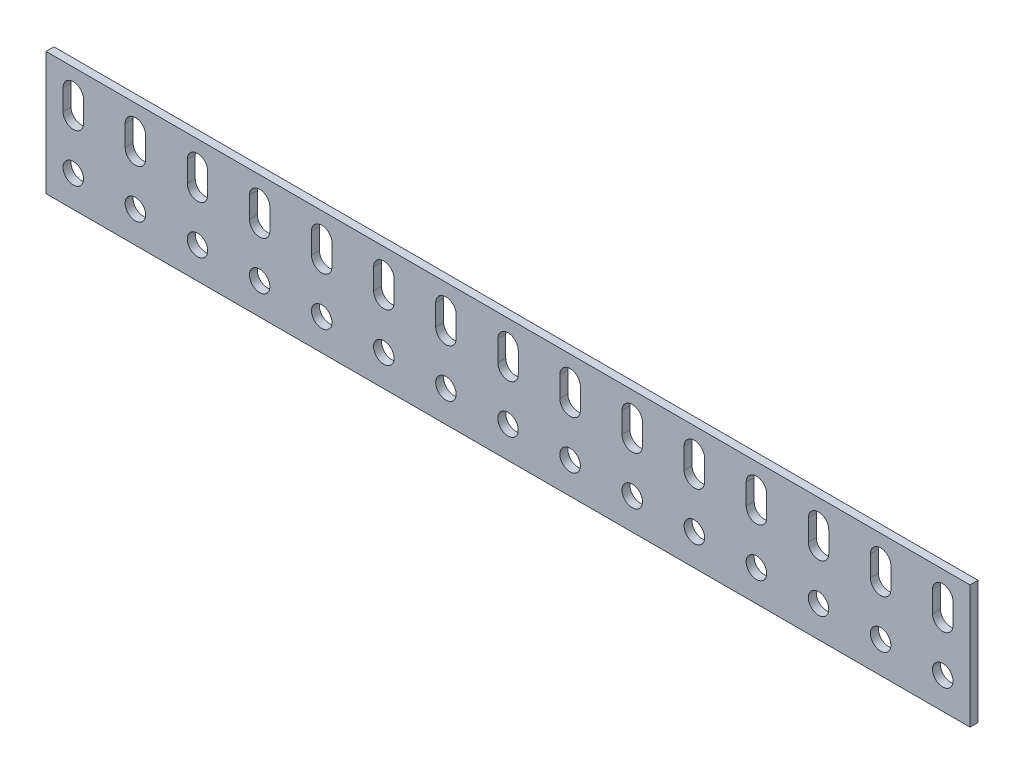
from build123d import *

# Parameters (mm, degrees)
SKETCH1_W           = 190.5
SKETCH1_H           = 25.4
BOSS_EXTRUDE3_DEPTH = 1.64
SKETCH1_9_R         = 2.11
CUT_EXTRUDE8_DEPTH  = 1.64


with BuildPart() as part:
    # Sketch1 → Boss-Extrude3 (new body)
    with BuildSketch(Plane.XY):
        with Locations((-58.027959696, 19.972489638)):
            Rectangle(SKETCH1_W, SKETCH1_H)
    extrude(amount=BOSS_EXTRUDE3_DEPTH)

    # Sketch1<9> → Cut-Extrude8 (cut)
    with BuildSketch(Plane.XY):
        with BuildLine():
            Line((33.702040304, 23.662489638), (33.702040304, 27.962489638))
            ThreePointArc((33.702040304, 27.962489638), (31.592040304, 30.072489638), (29.482040304, 27.962489638))
            Line((29.482040304, 27.962489638), (29.482040304, 23.662489638))
            ThreePointArc((29.482040304, 23.662489638), (31.592040304, 21.552489638), (33.702040304, 23.662489638))
        make_face()
        with BuildLine():
            Line((20.899183161, 23.662489638), (20.899183161, 27.962489638))
            ThreePointArc((20.899183161, 27.962489638), (18.789183161, 30.072489638), (16.679183161, 27.962489638))
            Line((16.679183161, 27.962489638), (16.679183161, 23.662489638))
            ThreePointArc((16.679183161, 23.662489638), (18.789183161, 21.552489638), (20.899183161, 23.662489638))
        make_face()
        with BuildLine():
            Line((8.096326018, 23.662489638), (8.096326018, 27.962489638))
            ThreePointArc((8.096326018, 27.962489638), (5.986326018, 30.072489638), (3.876326018, 27.962489638))
            Line((3.876326018, 27.962489638), (3.876326018, 23.662489638))
            ThreePointArc((3.876326018, 23.662489638), (5.986326018, 21.552489638), (8.096326018, 23.662489638))
        make_face()
        with BuildLine():
            Line((-4.706531125, 23.662489638), (-4.706531125, 27.962489638))
            ThreePointArc((-4.706531125, 27.962489638), (-6.816531125, 30.072489638), (-8.926531125, 27.962489638))
            Line((-8.926531125, 27.962489638), (-8.926531125, 23.662489638))
            ThreePointArc((-8.926531125, 23.662489638), (-6.816531125, 21.552489638), (-4.706531125, 23.662489638))
        make_face()
        with BuildLine():
            Line((-17.509388268, 23.662489638), (-17.509388268, 27.962489638))
            ThreePointArc((-17.509388268, 27.962489638), (-19.619388268, 30.072489638), (-21.729388268, 27.962489638))
            Line((-21.729388268, 27.962489638), (-21.729388268, 23.662489638))
            ThreePointArc((-21.729388268, 23.662489638), (-19.619388268, 21.552489638), (-17.509388268, 23.662489638))
        make_face()
        with BuildLine():
            Line((-30.312245411, 23.662489638), (-30.312245411, 27.962489638))
            ThreePointArc((-30.312245411, 27.962489638), (-32.422245411, 30.072489638), (-34.532245411, 27.962489638))
            Line((-34.532245411, 27.962489638), (-34.532245411, 23.662489638))
            ThreePointArc((-34.532245411, 23.662489638), (-32.422245411, 21.552489638), (-30.312245411, 23.662489638))
        make_face()
        with BuildLine():
            Line((-43.115102553, 23.662489638), (-43.115102553, 27.962489638))
            ThreePointArc((-43.115102553, 27.962489638), (-45.225102553, 30.072489638), (-47.335102553, 27.962489638))
            Line((-47.335102553, 27.962489638), (-47.335102553, 23.662489638))
            ThreePointArc((-47.335102553, 23.662489638), (-45.225102553, 21.552489638), (-43.115102553, 23.662489638))
        make_face()
        with BuildLine():
            Line((-55.917959696, 23.662489638), (-55.917959696, 27.962489638))
            ThreePointArc((-55.917959696, 27.962489638), (-58.027959696, 30.072489638), (-60.137959696, 27.962489638))
            Line((-60.137959696, 27.962489638), (-60.137959696, 23.662489638))
            ThreePointArc((-60.137959696, 23.662489638), (-58.027959696, 21.552489638), (-55.917959696, 23.662489638))
        make_face()
        with BuildLine():
            Line((-68.720816839, 23.662489638), (-68.720816839, 27.962489638))
            ThreePointArc((-68.720816839, 27.962489638), (-70.830816839, 30.072489638), (-72.940816839, 27.962489638))
            Line((-72.940816839, 27.962489638), (-72.940816839, 23.662489638))
            ThreePointArc((-72.940816839, 23.662489638), (-70.830816839, 21.552489638), (-68.720816839, 23.662489638))
        make_face()
        with BuildLine():
            Line((-81.523673982, 23.662489638), (-81.523673982, 27.962489638))
            ThreePointArc((-81.523673982, 27.962489638), (-83.633673982, 30.072489638), (-85.743673982, 27.962489638))
            Line((-85.743673982, 27.962489638), (-85.743673982, 23.662489638))
            ThreePointArc((-85.743673982, 23.662489638), (-83.633673982, 21.552489638), (-81.523673982, 23.662489638))
        make_face()
        with BuildLine():
            Line((-94.326531125, 23.662489638), (-94.326531125, 27.962489638))
            ThreePointArc((-94.326531125, 27.962489638), (-96.436531125, 30.072489638), (-98.546531125, 27.962489638))
            Line((-98.546531125, 27.962489638), (-98.546531125, 23.662489638))
            ThreePointArc((-98.546531125, 23.662489638), (-96.436531125, 21.552489638), (-94.326531125, 23.662489638))
        make_face()
        with BuildLine():
            Line((-107.129388268, 23.662489638), (-107.129388268, 27.962489638))
            ThreePointArc((-107.129388268, 27.962489638), (-109.239388268, 30.072489638), (-111.349388268, 27.962489638))
            Line((-111.349388268, 27.962489638), (-111.349388268, 23.662489638))
            ThreePointArc((-111.349388268, 23.662489638), (-109.239388268, 21.552489638), (-107.129388268, 23.662489638))
        make_face()
        with BuildLine():
            Line((-119.932245411, 23.662489638), (-119.932245411, 27.962489638))
            ThreePointArc((-119.932245411, 27.962489638), (-122.042245411, 30.072489638), (-124.152245411, 27.962489638))
            Line((-124.152245411, 27.962489638), (-124.152245411, 23.662489638))
            ThreePointArc((-124.152245411, 23.662489638), (-122.042245411, 21.552489638), (-119.932245411, 23.662489638))
        make_face()
        with BuildLine():
            Line((-132.735102553, 23.662489638), (-132.735102553, 27.962489638))
            ThreePointArc((-132.735102553, 27.962489638), (-134.845102553, 30.072489638), (-136.955102553, 27.962489638))
            Line((-136.955102553, 27.962489638), (-136.955102553, 23.662489638))
            ThreePointArc((-136.955102553, 23.662489638), (-134.845102553, 21.552489638), (-132.735102553, 23.662489638))
        make_face()
        with BuildLine():
            Line((-145.537959696, 23.662489638), (-145.537959696, 27.962489638))
            ThreePointArc((-145.537959696, 27.962489638), (-147.647959696, 30.072489638), (-149.757959696, 27.962489638))
            Line((-149.757959696, 27.962489638), (-149.757959696, 23.662489638))
            ThreePointArc((-149.757959696, 23.662489638), (-147.647959696, 21.552489638), (-145.537959696, 23.662489638))
        make_face()
        with Locations((-147.647959696, 13.742489638)):
            Circle(SKETCH1_9_R)
        with Locations((-134.845102553, 13.742489638)):
            Circle(SKETCH1_9_R)
        with Locations((-122.042245411, 13.742489638)):
            Circle(SKETCH1_9_R)
        with Locations((-109.239388268, 13.742489638)):
            Circle(SKETCH1_9_R)
        with Locations((-96.436531125, 13.742489638)):
            Circle(SKETCH1_9_R)
        with Locations((-83.633673982, 13.742489638)):
            Circle(SKETCH1_9_R)
        with Locations((-70.830816839, 13.742489638)):
            Circle(SKETCH1_9_R)
        with Locations((-58.027959696, 13.742489638)):
            Circle(SKETCH1_9_R)
        with Locations((-45.225102553, 13.742489638)):
            Circle(SKETCH1_9_R)
        with Locations((-32.422245411, 13.742489638)):
            Circle(SKETCH1_9_R)
        with Locations((-19.619388268, 13.742489638)):
            Circle(SKETCH1_9_R)
        with Locations((-6.816531125, 13.742489638)):
            Circle(SKETCH1_9_R)
        with Locations((5.986326018, 13.742489638)):
            Circle(SKETCH1_9_R)
        with Locations((18.789183161, 13.742489638)):
            Circle(SKETCH1_9_R)
        with Locations((31.592040304, 13.742489638)):
            Circle(SKETCH1_9_R)
    extrude(amount=CUT_EXTRUDE8_DEPTH, mode=Mode.SUBTRACT)


solid = part.part
